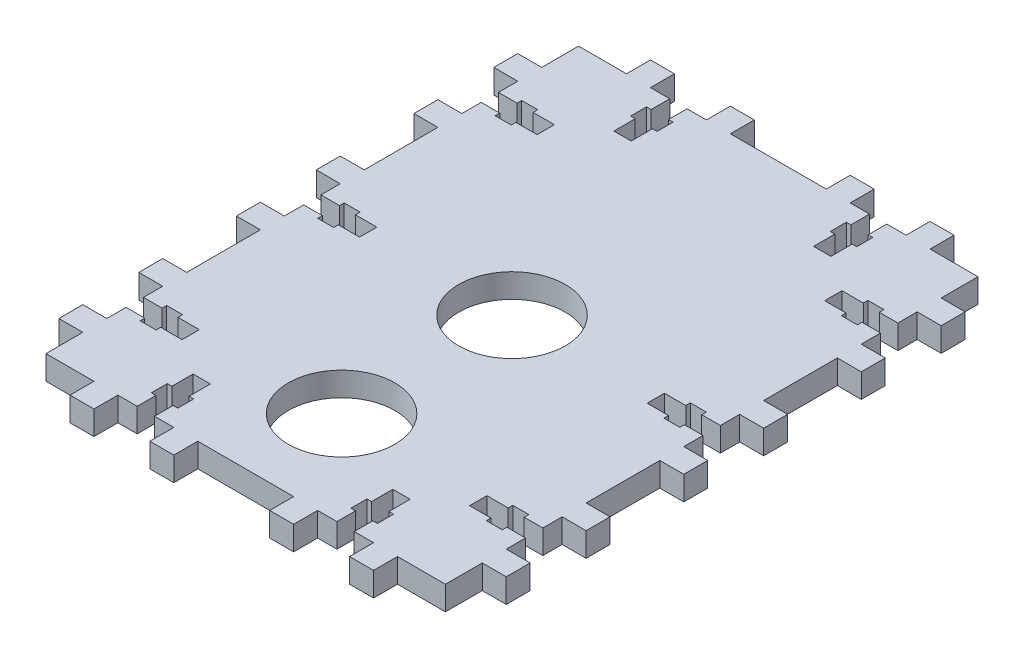
from build123d import *

# Parameters (mm, degrees)
SKETCH1_W           = 9
SKETCH1_H           = 9
SKETCH1_R           = 20
BOSS_EXTRUDE1_DEPTH = 9


with BuildPart() as part:
    # Sketch1 → Boss-Extrude1 (new body)
    # profile 1 of 37: a face of its own
    with BuildSketch(Plane(origin=(0, 0, 0), x_dir=(1, 0, 0), z_dir=(0, 1, 0))):
        with Locations((-52.5, -104.5)):
            Rectangle(SKETCH1_W, SKETCH1_H)
    # profile 2 of 37: a face of its own
    with BuildSketch(Plane(origin=(0, 0, 0), x_dir=(1, 0, 0), z_dir=(0, 1, 0))):
        with Locations((-52.5, -104.5)):
            Rectangle(SKETCH1_W, SKETCH1_H)
    # profile 3 of 37: a face of its own
    with BuildSketch(Plane(origin=(0, 0, 0), x_dir=(1, 0, 0), z_dir=(0, 1, 0))):
        with Locations((-79.5, -81.666666667)):
            Rectangle(SKETCH1_W, SKETCH1_H)
    # profile 4 of 37: a face of its own
    with BuildSketch(Plane(origin=(0, 0, 0), x_dir=(1, 0, 0), z_dir=(0, 1, 0))):
        with Locations((-79.5, -81.666666667)):
            Rectangle(SKETCH1_W, SKETCH1_H)
    # profile 5 of 37: a face of its own
    with BuildSketch(Plane(origin=(0, 0, 0), x_dir=(1, 0, 0), z_dir=(0, 1, 0))):
        with Locations((-79.5, -15)):
            Rectangle(SKETCH1_W, SKETCH1_H)
    # profile 6 of 37: a face of its own
    with BuildSketch(Plane(origin=(0, 0, 0), x_dir=(1, 0, 0), z_dir=(0, 1, 0))):
        with Locations((-79.5, -51.666666667)):
            Rectangle(SKETCH1_W, SKETCH1_H)
    # profile 7 of 37: a face of its own
    with BuildSketch(Plane(origin=(0, 0, 0), x_dir=(1, 0, 0), z_dir=(0, 1, 0))):
        with Locations((-79.5, 51.666666667)):
            Rectangle(SKETCH1_W, SKETCH1_H)
    # profile 8 of 37: a face of its own
    with BuildSketch(Plane(origin=(0, 0, 0), x_dir=(1, 0, 0), z_dir=(0, 1, 0))):
        with Locations((-79.5, 15)):
            Rectangle(SKETCH1_W, SKETCH1_H)
    # profile 9 of 37: a face of its own
    with BuildSketch(Plane(origin=(0, 0, 0), x_dir=(1, 0, 0), z_dir=(0, 1, 0))):
        with Locations((-79.5, 81.666666667)):
            Rectangle(SKETCH1_W, SKETCH1_H)
    # profile 10 of 37: a face of its own
    with BuildSketch(Plane(origin=(0, 0, 0), x_dir=(1, 0, 0), z_dir=(0, 1, 0))):
        with Locations((-79.5, 81.666666667)):
            Rectangle(SKETCH1_W, SKETCH1_H)
    # profile 11 of 37: a face of its own
    with BuildSketch(Plane(origin=(0, 0, 0), x_dir=(1, 0, 0), z_dir=(0, 1, 0))):
        with Locations((-52.5, 104.5)):
            Rectangle(SKETCH1_W, SKETCH1_H)
    # profile 12 of 37: a face of its own
    with BuildSketch(Plane(origin=(0, 0, 0), x_dir=(1, 0, 0), z_dir=(0, 1, 0))):
        with Locations((-52.5, 104.5)):
            Rectangle(SKETCH1_W, SKETCH1_H)
    # profile 13 of 37: a face of its own
    with BuildSketch(Plane(origin=(0, 0, 0), x_dir=(1, 0, 0), z_dir=(0, 1, 0))):
        with Locations((-52.5, 104.5)):
            Rectangle(SKETCH1_W, SKETCH1_H)
    # profile 14 of 37: a face of its own
    with BuildSketch(Plane(origin=(0, 0, 0), x_dir=(1, 0, 0), z_dir=(0, 1, 0))):
        with Locations((-52.5, 104.5)):
            Rectangle(SKETCH1_W, SKETCH1_H)
    # profile 15 of 37: a face of its own
    with BuildSketch(Plane(origin=(0, 0, 0), x_dir=(1, 0, 0), z_dir=(0, 1, 0))):
        with Locations((-22.5, 104.5)):
            Rectangle(SKETCH1_W, SKETCH1_H)
    # profile 16 of 37: a face of its own
    with BuildSketch(Plane(origin=(0, 0, 0), x_dir=(1, 0, 0), z_dir=(0, 1, 0))):
        with Locations((22.5, 104.5)):
            Rectangle(SKETCH1_W, SKETCH1_H)
    # profile 17 of 37: a face of its own
    with BuildSketch(Plane(origin=(0, 0, 0), x_dir=(1, 0, 0), z_dir=(0, 1, 0))):
        with Locations((52.5, 104.5)):
            Rectangle(SKETCH1_W, SKETCH1_H)
    # profile 18 of 37: a face of its own
    with BuildSketch(Plane(origin=(0, 0, 0), x_dir=(1, 0, 0), z_dir=(0, 1, 0))):
        with Locations((52.5, 104.5)):
            Rectangle(SKETCH1_W, SKETCH1_H)
    # profile 19 of 37: a face of its own
    with BuildSketch(Plane(origin=(0, 0, 0), x_dir=(1, 0, 0), z_dir=(0, 1, 0))):
        with Locations((52.5, 104.5)):
            Rectangle(SKETCH1_W, SKETCH1_H)
    # profile 20 of 37: a face of its own
    with BuildSketch(Plane(origin=(0, 0, 0), x_dir=(1, 0, 0), z_dir=(0, 1, 0))):
        with Locations((52.5, 104.5)):
            Rectangle(SKETCH1_W, SKETCH1_H)
    # profile 21 of 37: a face of its own
    with BuildSketch(Plane(origin=(0, 0, 0), x_dir=(1, 0, 0), z_dir=(0, 1, 0))):
        with Locations((79.5, 81.666666667)):
            Rectangle(SKETCH1_W, SKETCH1_H)
    # profile 22 of 37: a face of its own
    with BuildSketch(Plane(origin=(0, 0, 0), x_dir=(1, 0, 0), z_dir=(0, 1, 0))):
        with Locations((79.5, 81.666666667)):
            Rectangle(SKETCH1_W, SKETCH1_H)
    # profile 23 of 37: a face of its own
    with BuildSketch(Plane(origin=(0, 0, 0), x_dir=(1, 0, 0), z_dir=(0, 1, 0))):
        with Locations((-52.5, -104.5)):
            Rectangle(SKETCH1_W, SKETCH1_H)
    # profile 24 of 37: a face of its own
    with BuildSketch(Plane(origin=(0, 0, 0), x_dir=(1, 0, 0), z_dir=(0, 1, 0))):
        with Locations((-52.5, -104.5)):
            Rectangle(SKETCH1_W, SKETCH1_H)
    # profile 25 of 37: a face of its own
    with BuildSketch(Plane(origin=(0, 0, 0), x_dir=(1, 0, 0), z_dir=(0, 1, 0))):
        with Locations((-22.5, -104.5)):
            Rectangle(SKETCH1_W, SKETCH1_H)
    # profile 26 of 37: a face of its own
    with BuildSketch(Plane(origin=(0, 0, 0), x_dir=(1, 0, 0), z_dir=(0, 1, 0))):
        with Locations((22.5, -104.5)):
            Rectangle(SKETCH1_W, SKETCH1_H)
    # profile 27 of 37: a face of its own
    with BuildSketch(Plane(origin=(0, 0, 0), x_dir=(1, 0, 0), z_dir=(0, 1, 0))):
        with Locations((52.5, -104.5)):
            Rectangle(SKETCH1_W, SKETCH1_H)
    # profile 28 of 37: a face of its own
    with BuildSketch(Plane(origin=(0, 0, 0), x_dir=(1, 0, 0), z_dir=(0, 1, 0))):
        with Locations((52.5, -104.5)):
            Rectangle(SKETCH1_W, SKETCH1_H)
    # profile 29 of 37: a face of its own
    with BuildSketch(Plane(origin=(0, 0, 0), x_dir=(1, 0, 0), z_dir=(0, 1, 0))):
        with Locations((52.5, -104.5)):
            Rectangle(SKETCH1_W, SKETCH1_H)
    # profile 30 of 37: a face of its own
    with BuildSketch(Plane(origin=(0, 0, 0), x_dir=(1, 0, 0), z_dir=(0, 1, 0))):
        with Locations((52.5, -104.5)):
            Rectangle(SKETCH1_W, SKETCH1_H)
    # profile 31 of 37: a face of its own
    with BuildSketch(Plane(origin=(0, 0, 0), x_dir=(1, 0, 0), z_dir=(0, 1, 0))):
        with Locations((79.5, -81.666666667)):
            Rectangle(SKETCH1_W, SKETCH1_H)
    # profile 32 of 37: a face of its own
    with BuildSketch(Plane(origin=(0, 0, 0), x_dir=(1, 0, 0), z_dir=(0, 1, 0))):
        with Locations((79.5, -81.666666667)):
            Rectangle(SKETCH1_W, SKETCH1_H)
    # profile 33 of 37: a face of its own
    with BuildSketch(Plane(origin=(0, 0, 0), x_dir=(1, 0, 0), z_dir=(0, 1, 0))):
        with Locations((79.5, -51.666666667)):
            Rectangle(SKETCH1_W, SKETCH1_H)
    # profile 34 of 37: a face of its own
    with BuildSketch(Plane(origin=(0, 0, 0), x_dir=(1, 0, 0), z_dir=(0, 1, 0))):
        with Locations((79.5, -15)):
            Rectangle(SKETCH1_W, SKETCH1_H)
    # profile 35 of 37: a face of its own
    with BuildSketch(Plane(origin=(0, 0, 0), x_dir=(1, 0, 0), z_dir=(0, 1, 0))):
        with Locations((79.5, 15)):
            Rectangle(SKETCH1_W, SKETCH1_H)
    # profile 36 of 37: a face of its own
    with BuildSketch(Plane(origin=(0, 0, 0), x_dir=(1, 0, 0), z_dir=(0, 1, 0))):
        with Locations((79.5, 51.666666667)):
            Rectangle(SKETCH1_W, SKETCH1_H)
    # profile 37 of 37: a face of its own
    with BuildSketch(Plane(origin=(0, 0, 0), x_dir=(1, 0, 0), z_dir=(0, 1, 0))):
        Polygon((-75, -86.166666667), (-75, -100), (-57, -100), (-48, -100), (-40.75, -100), (-40.75, -93), (-42.475, -93), (-42.475, -87), (-40.75, -87), (-40.75, -79), (-34.25, -79), (-34.25, -87), (-32.525, -87), (-32.525, -93), (-34.25, -93), (-34.25, -100), (-27, -100), (-18, -100), (18, -100), (27, -100), (34.25, -100), (34.25, -93), (32.525, -93), (32.525, -87), (34.25, -87), (34.25, -79), (40.75, -79), (40.75, -87), (42.475, -87), (42.475, -93), (40.75, -93), (40.75, -100), (48, -100), (57, -100), (75, -100), (75, -86.166666667), (75, -77.166666667), (75, -69.916666667), (68, -69.916666667), (68, -71.641666667), (62, -71.641666667), (62, -69.916666667), (54, -69.916666667), (54, -63.416666667), (62, -63.416666667), (62, -61.691666667), (68, -61.691666667), (68, -63.416666667), (75, -63.416666667), (75, -56.166666667), (75, -47.166666667), (75, -19.5), (75, -10.5), (75, -3.25), (68, -3.25), (68, -4.975), (62, -4.975), (62, -3.25), (54, -3.25), (54, 3.25), (62, 3.25), (62, 4.975), (68, 4.975), (68, 3.25), (75, 3.25), (75, 10.5), (75, 19.5), (75, 47.166666667), (75, 56.166666667), (75, 63.416666667), (68, 63.416666667), (68, 61.691666667), (62, 61.691666667), (62, 63.416666667), (54, 63.416666667), (54, 69.916666667), (62, 69.916666667), (62, 71.641666667), (68, 71.641666667), (68, 69.916666667), (75, 69.916666667), (75, 77.166666667), (75, 86.166666667), (75, 100), (57, 100), (48, 100), (40.75, 100), (40.75, 93), (42.475, 93), (42.475, 87), (40.75, 87), (40.75, 79), (34.25, 79), (34.25, 87), (32.525, 87), (32.525, 93), (34.25, 93), (34.25, 100), (27, 100), (18, 100), (-18, 100), (-27, 100), (-34.25, 100), (-34.25, 93), (-32.525, 93), (-32.525, 87), (-34.25, 87), (-34.25, 79), (-40.75, 79), (-40.75, 87), (-42.475, 87), (-42.475, 93), (-40.75, 93), (-40.75, 100), (-48, 100), (-57, 100), (-75, 100), (-75, 86.166666667), (-75, 77.166666667), (-75, 69.916666667), (-68, 69.916666667), (-68, 71.641666667), (-62, 71.641666667), (-62, 69.916666667), (-54, 69.916666667), (-54, 63.416666667), (-62, 63.416666667), (-62, 61.691666667), (-68, 61.691666667), (-68, 63.416666667), (-75, 63.416666667), (-75, 56.166666667), (-75, 47.166666667), (-75, 19.5), (-75, 10.5), (-75, 3.25), (-68, 3.25), (-68, 4.975), (-62, 4.975), (-62, 3.25), (-54, 3.25), (-54, -3.25), (-62, -3.25), (-62, -4.975), (-68, -4.975), (-68, -3.25), (-75, -3.25), (-75, -10.5), (-75, -19.5), (-75, -47.166666667), (-75, -56.166666667), (-75, -63.416666667), (-68, -63.416666667), (-68, -61.691666667), (-62, -61.691666667), (-62, -63.416666667), (-54, -63.416666667), (-54, -69.916666667), (-62, -69.916666667), (-62, -71.641666667), (-68, -71.641666667), (-68, -69.916666667), (-75, -69.916666667), (-75, -77.166666667), align=None)
        with Locations(Location((0, -64, 0), (0, 0, 270))):
            Circle(SKETCH1_R, mode=Mode.SUBTRACT)
        with Locations(Location((0, 0, 0), (0, 0, 270))):
            Circle(SKETCH1_R, mode=Mode.SUBTRACT)
    extrude(amount=BOSS_EXTRUDE1_DEPTH)


solid = part.part
